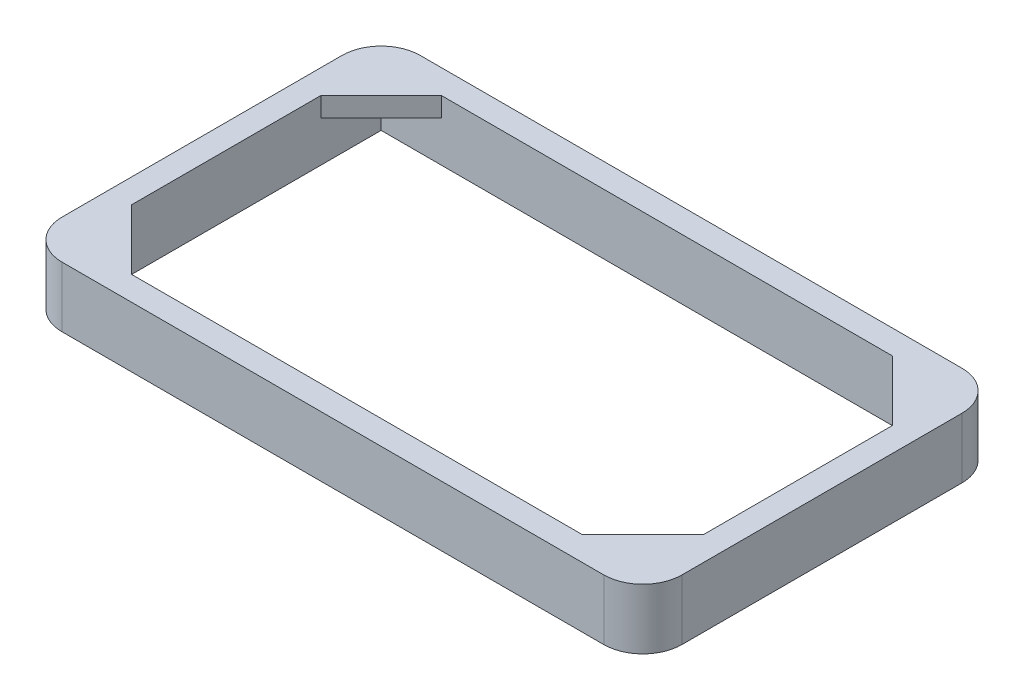
from build123d import *

# Parameters (mm, degrees)
SKETCH1_W           = 205.38
SKETCH1_H           = 118.65
SKETCH1_W_2         = 189.38
SKETCH1_H_2         = 102.65
BOSS_EXTRUDE1_DEPTH = 13.5
SKETCH3_W           = 205.38
SKETCH3_H           = 118.65
BOSS_EXTRUDE2_DEPTH = 6.5
SKETCH4_R           = 2.5
CUT_EXTRUDE1_DEPTH  = 6
FILLET1_R           = 12.94


with BuildPart() as part:
    # Sketch1 → Boss-Extrude1 (new body)
    with BuildSketch(Plane(origin=(0, 0, 0), x_dir=(1, 0, 0), z_dir=(0, 1, 0))):
        Rectangle(SKETCH1_W, SKETCH1_H)
        Rectangle(SKETCH1_W_2, SKETCH1_H_2, mode=Mode.SUBTRACT)
    extrude(amount=BOSS_EXTRUDE1_DEPTH)

    # Sketch3 → Boss-Extrude2 (add)
    with BuildSketch(Plane(origin=(0, 13.5, 0), x_dir=(1, 0, 0), z_dir=(0, 1, 0))):
        Rectangle(SKETCH3_W, SKETCH3_H)
        Polygon((-94.69, 31.325), (-74.69, 51.325), (74.69, 51.325), (94.69, 31.325), (94.69, -31.325), (74.69, -51.325), (-74.69, -51.325), (-94.69, -31.325), align=None, mode=Mode.SUBTRACT)
    extrude(amount=BOSS_EXTRUDE2_DEPTH)

    # Sketch4 → Cut-Extrude1 (cut)
    with BuildSketch(Plane.XZ.offset(-13.5)):
        with Locations(Location((-88.94, 45.575, 0), (0, 0, 270))):
            Circle(SKETCH4_R)
        with Locations(Location((88.94, 45.575, 0), (0, 0, 90))):
            Circle(SKETCH4_R)
        with Locations(Location((88.94, -45.575, 0), (0, 0, 270))):
            Circle(SKETCH4_R)
        with Locations(Location((-88.94, -45.575, 0), (0, 0, 90))):
            Circle(SKETCH4_R)
    extrude(amount=-CUT_EXTRUDE1_DEPTH, mode=Mode.SUBTRACT)

    # Fillet1
    fillet1_edges = [part.edges().sort_by_distance(p)[0] for p in [
        (102.69, 10, 59.325),
        (-102.69, 10, 59.325),
        (-102.69, 10, -59.325),
        (102.69, 10, -59.325),
    ]]
    fillet(fillet1_edges, radius=FILLET1_R)


solid = part.part
